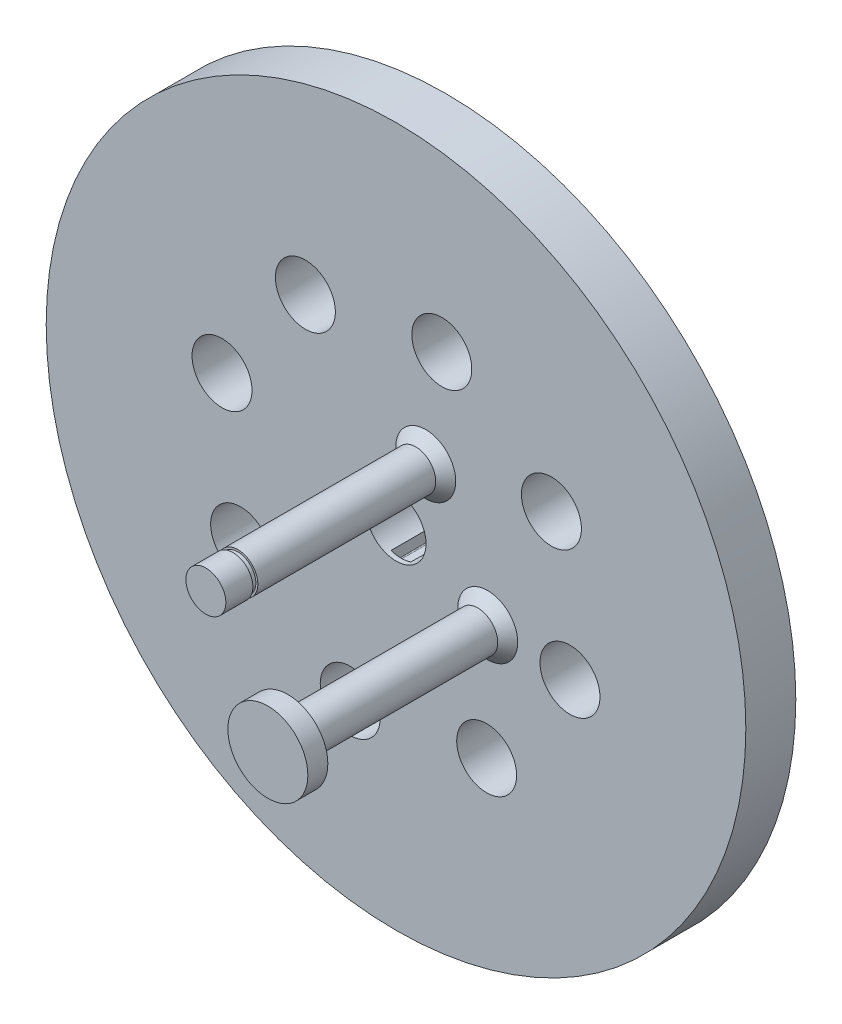
from build123d import *

# Parameters (mm, degrees)
SKETCH_1_R          = 35
SKETCH_1_R_2        = 3
EXTRUDE_1_DEPTH     = 5
SKETCH_3_R          = 3
CUT_EXTRUDE_2_DEPTH = 50.749371855
SKETCH_4_R          = 2
EXTRUDE_2_DEPTH     = 22
CUT_EXTRUDE_START   = -3.2
SKETCH_6_R          = 2
SKETCH_6_R_2        = 1.8
CUT_EXTRUDE_3_DEPTH = 0.5
SKETCH_7_R          = 4
EXTRUDE_3_DEPTH     = 2
CHAMFER_1_SIZE      = 1
CUT_EXTRUDE_START_2 = -0.5
SKETCH_9_W          = 2
SKETCH_9_H          = 2
CUT_EXTRUDE_5_DEPTH = 4
FILLET_1_R          = 0.1


with BuildPart() as part:
    # 草图1 → 凸台-拉伸1 (new body)
    with BuildSketch(Plane.XY):
        Circle(SKETCH_1_R)
        Circle(SKETCH_1_R_2, mode=Mode.SUBTRACT)
    extrude(amount=EXTRUDE_1_DEPTH)

    # 草图3 → 切除-拉伸2 (cut, through all)
    with BuildSketch(Plane(origin=(0, 0, 0), x_dir=(-1, 0, 0), z_dir=(0, 0, -1))):
        with Locations((-4.582105158, 17.407019053)):
            Circle(SKETCH_3_R)
        with Locations((9.068583583, 15.548658842)):
            Circle(SKETCH_3_R)
        with Locations((17.407019053, 4.582105158)):
            Circle(SKETCH_3_R)
        with Locations((15.548658842, -9.068583583)):
            Circle(SKETCH_3_R)
        with Locations((4.582105158, -17.407019053)):
            Circle(SKETCH_3_R)
        with Locations((-9.068583583, -15.548658842)):
            Circle(SKETCH_3_R)
        with Locations((-17.407019053, -4.582105158)):
            Circle(SKETCH_3_R)
        with Locations((-15.548658842, 9.068583583)):
            Circle(SKETCH_3_R)
    extrude(amount=-CUT_EXTRUDE_2_DEPTH, mode=Mode.SUBTRACT)

    # 草图4 → 凸台-拉伸2 (add)
    with BuildSketch(Plane.XY.offset(5)):
        with Locations((2.976659474, 6.884003078)):
            Circle(SKETCH_4_R)
        with Locations((9.178670771, -3.968879298)):
            Circle(SKETCH_4_R)
    extrude(amount=EXTRUDE_2_DEPTH)

    # 草图6 → 切除-拉伸3 (cut)
    with BuildSketch(Plane.XY.offset(27).offset(CUT_EXTRUDE_START)):
        with Locations((2.976659474, 6.884003078)):
            Circle(SKETCH_6_R)
        with Locations((2.976659474, 6.884003078)):
            Circle(SKETCH_6_R_2, mode=Mode.SUBTRACT)
    extrude(amount=CUT_EXTRUDE_3_DEPTH, mode=Mode.SUBTRACT)

    # 草图7 → 凸台-拉伸3 (add)
    with BuildSketch(Plane.XY.offset(27)):
        with Locations((9.178670771, -3.968879298)):
            Circle(SKETCH_7_R)
    extrude(amount=-EXTRUDE_3_DEPTH)

    # 倒角1
    chamfer_1_edges = [part.edges().sort_by_distance(p)[0] for p in [
        (7.178670771, -3.968879298, 5),
        (0.976659474, 6.884003078, 5),
    ]]
    chamfer(chamfer_1_edges, length=CHAMFER_1_SIZE)

    # 草图9 → 切除-拉伸5 (cut)
    with BuildSketch(Plane.XY.offset(5).offset(CUT_EXTRUDE_START_2)):
        with Locations((0, -3)):
            Rectangle(SKETCH_9_W, SKETCH_9_H)
    extrude(amount=-CUT_EXTRUDE_5_DEPTH, mode=Mode.SUBTRACT)

    # 圆角1
    fillet_1_edges = [part.edges().sort_by_distance(p)[0] for p in [
        (-1, -4, 2.5),
        (1, -4, 2.5),
    ]]
    fillet(fillet_1_edges, radius=FILLET_1_R)


solid = part.part
